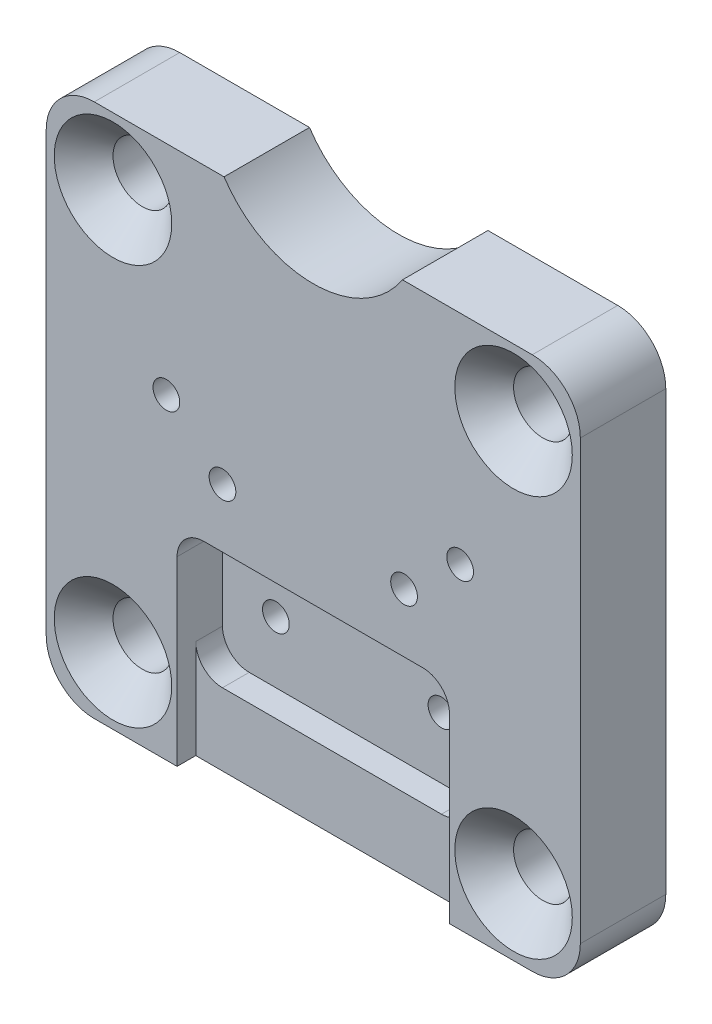
from build123d import *

# Parameters (mm, degrees)
ESQUISSE1_W                                    = 20
ESQUISSE1_H                                    = 20
BOSS_EXTRU_1_DEPTH                             = 3.2
CONG_1_R                                       = 1.8
DIAM_TRE_DU_PER_AGE_1_0_1_1_D                  = 1
ESQUISSE4_W                                    = 10.2
ESQUISSE4_H                                    = 7.8
ENL_V_MAT_EXTRU_1_DEPTH                        = 0.7
ESQUISSE5_W                                    = 10.2
ESQUISSE5_H                                    = 5.1
ENL_V_MAT_EXTRU_2_DEPTH                        = 1
CONG_2_R                                       = 1
FRAISAGE_POUR_VIS_T_TE_FRAIS_E_M21_D           = 2.2
FRAISAGE_POUR_VIS_T_TE_FRAIS_E_M21_CSINK_D     = 4.4
FRAISAGE_POUR_VIS_T_TE_FRAIS_E_M21_CSINK_ANGLE = 90
ESQUISSE8_R                                    = 4
ENL_V_MAT_EXTRU_3_DEPTH                        = 15.499655168


with BuildPart() as part:
    # Esquisse1 → Boss.-Extru.1 (new body)
    with BuildSketch(Plane.XY):
        Rectangle(ESQUISSE1_W, ESQUISSE1_H)
    extrude(amount=BOSS_EXTRU_1_DEPTH)

    # Congé1
    cong_1_edges = [part.edges().sort_by_distance(p)[0] for p in [
        (-10, 10, 1.6),
        (10, 10, 1.6),
        (10, -10, 1.6),
        (-10, -10, 1.6),
    ]]
    fillet(cong_1_edges, radius=CONG_1_R)

    # Diamètre du perçage Ø1.0 (1)1 (through all)
    with Locations(Plane.XY.offset(3.2)):
        with Locations((3.1, -5), (3.4, 0), (5.5, 1.85), (-5.5, 1.85), (-3.4, 0), (-3.1, -5)):
            Hole(DIAM_TRE_DU_PER_AGE_1_0_1_1_D / 2)

    # Esquisse4 → Enlèv. mat.-Extru.1 (cut)
    with BuildSketch(Plane.XY.offset(3.2)):
        with Locations((0, -6.1)):
            Rectangle(ESQUISSE4_W, ESQUISSE4_H)
    extrude(amount=-ENL_V_MAT_EXTRU_1_DEPTH, mode=Mode.SUBTRACT)

    # Esquisse5 → Enlèv. mat.-Extru.2 (cut)
    with BuildSketch(Plane.XY.offset(2.5)):
        with Locations((0, -4.75)):
            Rectangle(ESQUISSE5_W, ESQUISSE5_H)
    extrude(amount=-ENL_V_MAT_EXTRU_2_DEPTH, mode=Mode.SUBTRACT)

    # Congé2
    cong_2_edges = [part.edges().sort_by_distance(p)[0] for p in [
        (-5.1, -2.2, 2.35),
        (5.1, -2.2, 2.35),
        (-5.1, -7.3, 2),
        (5.1, -7.3, 2),
    ]]
    fillet(cong_2_edges, radius=CONG_2_R)

    # Fraisage pour vis à tête fraisée M21 (through all)
    with Locations(Plane.XY.offset(3.2)):
        with Locations((-7.5, 7.5), (-7.5, -7.5), (7.5, -7.5), (7.5, 7.5)):
            CounterSinkHole(FRAISAGE_POUR_VIS_T_TE_FRAIS_E_M21_D / 2, FRAISAGE_POUR_VIS_T_TE_FRAIS_E_M21_CSINK_D / 2, counter_sink_angle=FRAISAGE_POUR_VIS_T_TE_FRAIS_E_M21_CSINK_ANGLE)

    # Esquisse8 → Enlèv. mat.-Extru.3 (cut, through all)
    with BuildSketch(Plane.XY.offset(3.2)):
        with Locations((0, 12.2)):
            Circle(ESQUISSE8_R)
    extrude(amount=-ENL_V_MAT_EXTRU_3_DEPTH, mode=Mode.SUBTRACT)


solid = part.part
